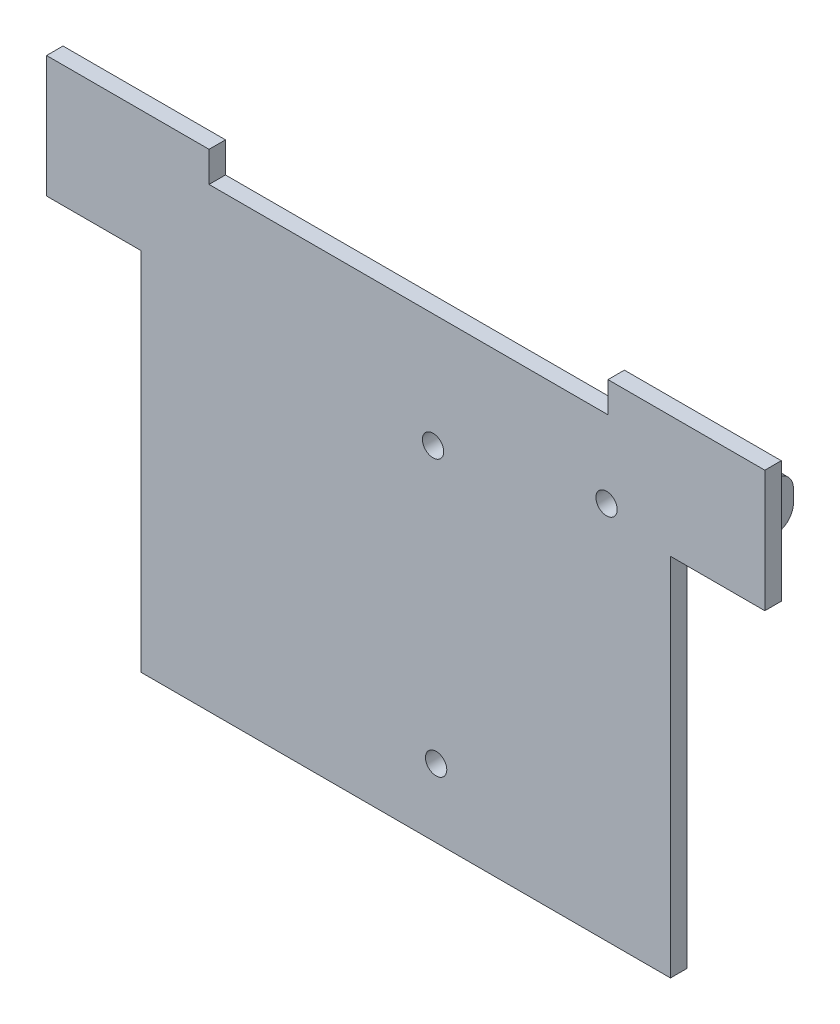
from build123d import *

# Parameters (mm, degrees)
SKETCH1_W           = 118
SKETCH1_H           = 80
BOSS_EXTRUDE1_DEPTH = 2.7
SKETCH3_W           = 5.5
SKETCH3_H           = 60
CUT_EXTRUDE1_DEPTH  = 2.7
SKETCH4_W           = 10
SKETCH4_H           = 60
CUT_EXTRUDE2_DEPTH  = 2.7
SKETCH7_W           = 4
SKETCH7_H           = 8
BOSS_EXTRUDE5_DEPTH = 8
SKETCH8_R           = 1.75
CUT_EXTRUDE4_DEPTH  = 131
FILLET1_R           = 3
SKETCH9_W           = 65.533885403
SKETCH9_H           = 5
CUT_EXTRUDE5_DEPTH  = 53
SKETCH10_R          = 1.75
CUT_EXTRUDE6_DEPTH  = 10


with BuildPart() as part:
    # Sketch1 → Boss-Extrude1 (new body)
    with BuildSketch(Plane.XY):
        with Locations((-14.766233766, 16)):
            Rectangle(SKETCH1_W, SKETCH1_H)
    extrude(amount=BOSS_EXTRUDE1_DEPTH)

    # Sketch3 → Cut-Extrude1 (cut)
    with BuildSketch(Plane.XY.offset(2.7)):
        with Locations((-71.016233766, 6)):
            Rectangle(SKETCH3_W, SKETCH3_H)
        with Locations((41.483766234, 6)):
            Rectangle(SKETCH3_W, SKETCH3_H)
    extrude(amount=-CUT_EXTRUDE1_DEPTH, mode=Mode.SUBTRACT)

    # Sketch4 → Cut-Extrude2 (cut)
    with BuildSketch(Plane.XY.offset(2.7)):
        with Locations((-63.266233766, 6)):
            Rectangle(SKETCH4_W, SKETCH4_H)
        with Locations((33.733766234, 6)):
            Rectangle(SKETCH4_W, SKETCH4_H)
    extrude(amount=-CUT_EXTRUDE2_DEPTH, mode=Mode.SUBTRACT)

    # Sketch7 → Boss-Extrude5 (add)
    with BuildSketch(Plane(origin=(0, 0, 0), x_dir=(-1, 0, 0), z_dir=(0, 0, -1))):
        with Locations((65.766233766, 44)):
            Rectangle(SKETCH7_W, SKETCH7_H)
        with Locations((-36.233766234, 44)):
            Rectangle(SKETCH7_W, SKETCH7_H)
    extrude(amount=BOSS_EXTRUDE5_DEPTH)

    # Sketch8 → Cut-Extrude4 (cut)
    with BuildSketch(Plane(origin=(38.233766234, 0, 0), x_dir=(0, 0, -1), z_dir=(1, 0, 0))):
        with Locations((4, 44)):
            Circle(SKETCH8_R)
    extrude(amount=-CUT_EXTRUDE4_DEPTH, mode=Mode.SUBTRACT)

    # Fillet1
    fillet1_edges = [part.edges().sort_by_distance(p)[0] for p in [
        (-65.766233766, 48, 0),
        (-65.766233766, 40, 0),
        (-65.766233766, 48, -8),
        (-65.766233766, 40, -8),
        (36.233766234, 40, 0),
        (36.233766234, 48, 0),
        (36.233766234, 40, -8),
        (36.233766234, 48, -8),
    ]]
    fillet(fillet1_edges, radius=FILLET1_R)

    # Sketch9 → Cut-Extrude5 (cut)
    with BuildSketch(Plane.XY.offset(2.7)):
        with Locations((-14.306023896, 53.5)):
            Rectangle(SKETCH9_W, SKETCH9_H)
    extrude(amount=-CUT_EXTRUDE5_DEPTH, mode=Mode.SUBTRACT)

    # Sketch10 → Cut-Extrude6 (cut)
    with BuildSketch(Plane(origin=(0, 0, 0), x_dir=(-1, 0, 0), z_dir=(0, 0, -1))):
        with Locations((9.766233766, -12.75)):
            Circle(SKETCH10_R)
        with Locations((10.266233766, 32.25)):
            Circle(SKETCH10_R)
        with Locations((-18.233766234, 38.25)):
            Circle(SKETCH10_R)
    extrude(amount=-CUT_EXTRUDE6_DEPTH, mode=Mode.SUBTRACT)


solid = part.part
